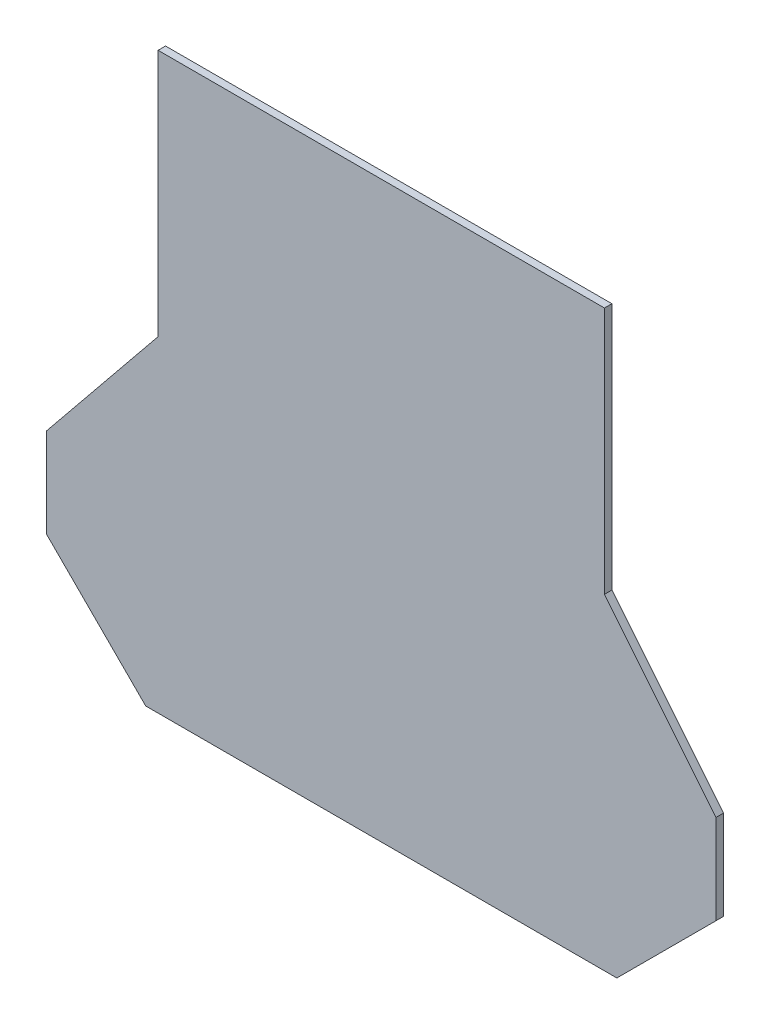
from build123d import *

# Parameters (mm, degrees)
BOSS_EXTRU_1_DEPTH = 3
CHANFREIN1_SIZE    = 40


with BuildPart() as part:
    # Esquisse1 → Boss.-Extru.1 (new body)
    with BuildSketch(Plane.XY):
        Polygon((115.873312648, 190.152785154), (115.873312648, 90.152785154), (160.873312648, 34.730964145), (160.873312648, -41.347214846), (-109.126687352, -41.347214846), (-109.126687352, 34.730964145), (-64.126687352, 90.152785154), (-64.126687352, 190.152785154), align=None)
    extrude(amount=BOSS_EXTRU_1_DEPTH)

    # Chanfrein1
    chanfrein1_edges = [part.edges().sort_by_distance(p)[0] for p in [
        (160.873312648, -41.347214846, 1.5),
        (-109.126687352, -41.347214846, 1.5),
    ]]
    chamfer(chanfrein1_edges, length=CHANFREIN1_SIZE)


solid = part.part
